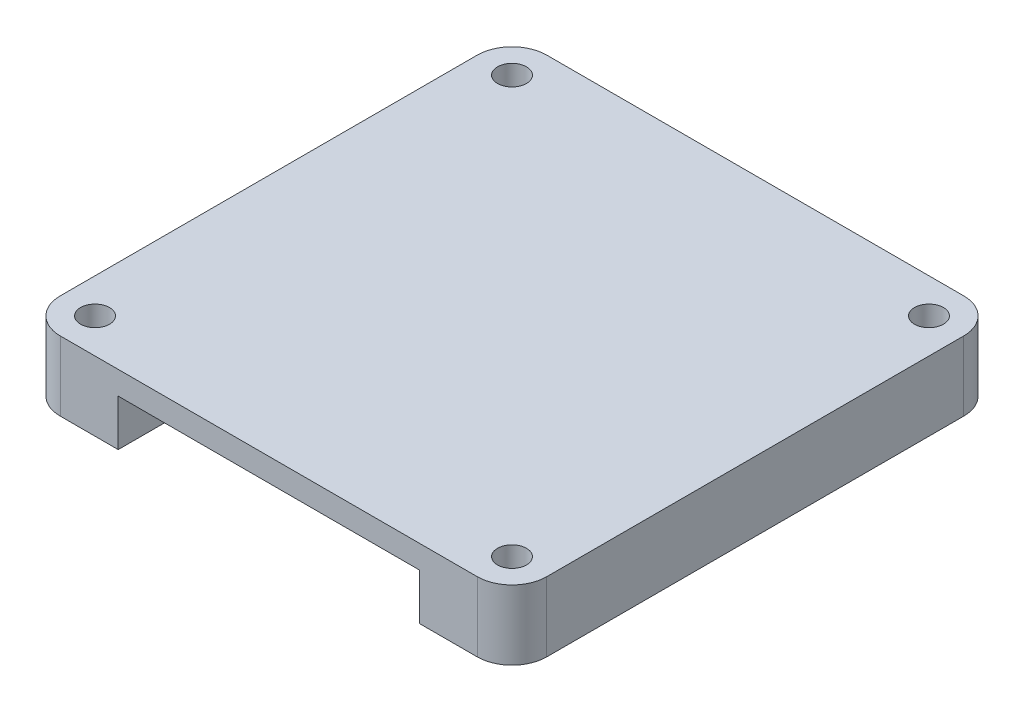
from build123d import *
from build123d.topology import SkipClean

# Parameters (mm, degrees)
SKETCH_1_R      = 1.25
EXTRUDE_1_DEPTH = 2
EXTRUDE_START   = 4
SKETCH_2_R      = 1.25
EXTRUDE_2_DEPTH = 4


with BuildPart() as part:
    # 草图1 → 凸台-拉伸1 (new body)
    with BuildSketch(Plane(origin=(0, 0, 0), x_dir=(1, 0, 0), z_dir=(0, 1, 0))):
        with BuildLine():
            Line((0, -3), (36, -3))
            ThreePointArc((36, -3), (38.121320344, -2.121320344), (39, 0))
            Line((39, 0), (39, 36))
            ThreePointArc((39, 36), (38.121320344, 38.121320344), (36, 39))
            Line((36, 39), (0, 39))
            ThreePointArc((0, 39), (-2.121320344, 38.121320344), (-3, 36))
            Line((-3, 36), (-3, 0))
            ThreePointArc((-3, 0), (-2.121320344, -2.121320344), (0, -3))
        make_face()
        with Locations(Location((0, 36, 0), (0, 0, 270))):
            Circle(SKETCH_1_R, mode=Mode.SUBTRACT)
        with Locations(Location((36, 36, 0), (0, 0, 270))):
            Circle(SKETCH_1_R, mode=Mode.SUBTRACT)
        with Locations(Location((0, 0, 0), (0, 0, 270))):
            Circle(SKETCH_1_R, mode=Mode.SUBTRACT)
        with Locations(Location((36, 0, 0), (0, 0, 270))):
            Circle(SKETCH_1_R, mode=Mode.SUBTRACT)
    extrude(amount=EXTRUDE_1_DEPTH)

    # 草图2 → 凸台-拉伸2 (add)
    # profile 1 of 2: a face of its own
    with SkipClean():  # the faces are left unmerged after this step: merging them gives an invalid solid
        with BuildSketch(Plane.XZ.offset(EXTRUDE_START)):
            with BuildLine():
                Line((39, 0), (39, -36))
                ThreePointArc((39, -36), (38.121320344, -38.121320344), (36, -39))
                Line((36, -39), (31, -39))
                Line((31, -39), (31, 3))
                Line((31, 3), (36, 3))
                ThreePointArc((36, 3), (38.121320344, 2.121320344), (39, 0))
            make_face()
            with Locations(Location((36, -36, 0), (0, 0, 270))):
                Circle(SKETCH_2_R, mode=Mode.SUBTRACT)
            with Locations(Location((36, 0, 0), (0, 0, 270))):
                Circle(SKETCH_2_R, mode=Mode.SUBTRACT)
        # profile 2 of 2: a face of its own
        with BuildSketch(Plane.XZ.offset(EXTRUDE_START)):
            with BuildLine():
                Line((-3, -36), (-3, 0))
                ThreePointArc((-3, 0), (-2.121320344, 2.121320344), (0, 3))
                Line((0, 3), (5, 3))
                Line((5, 3), (5, -39))
                Line((5, -39), (0, -39))
                ThreePointArc((0, -39), (-2.121320344, -38.121320344), (-3, -36))
            make_face()
            with Locations(Location((0, -36, 0), (0, 0, 270))):
                Circle(SKETCH_2_R, mode=Mode.SUBTRACT)
            with Locations(Location((0, 0, 0), (0, 0, 270))):
                Circle(SKETCH_2_R, mode=Mode.SUBTRACT)
        extrude(amount=-EXTRUDE_2_DEPTH)


solid = part.part
